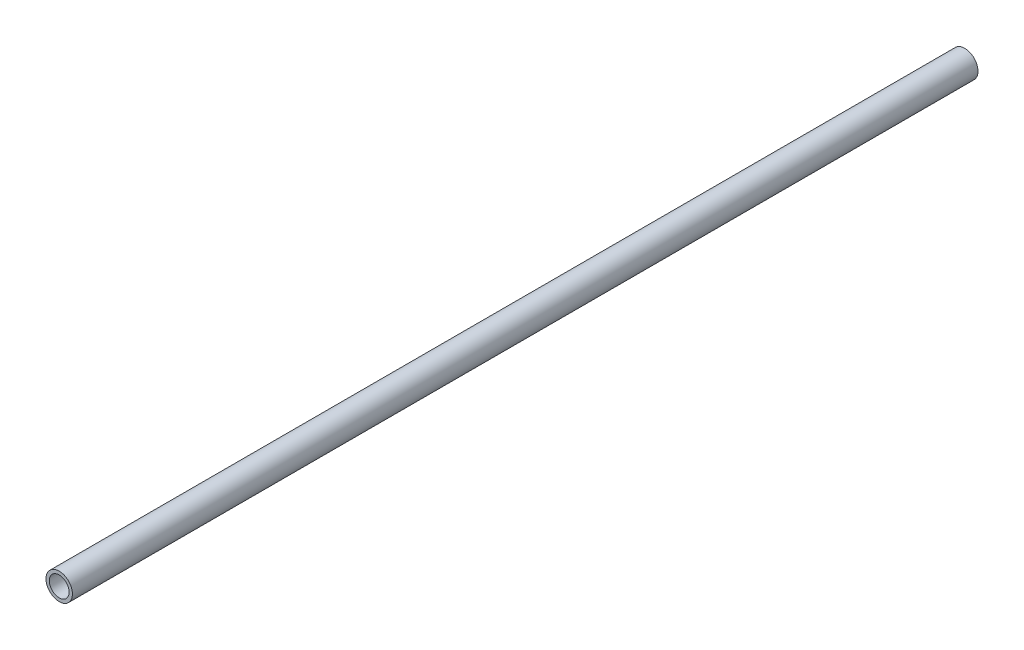
from build123d import *

# Parameters (mm, degrees)
ESQUISSE1_R        = 2
ESQUISSE1_R_2      = 1.5
EXTRU_MINCE1_DEPTH = 137


with BuildPart() as part:
    # Esquisse1 → Extru.-Mince1 (new body)
    with BuildSketch(Plane.XY):
        Circle(ESQUISSE1_R)
        Circle(ESQUISSE1_R_2, mode=Mode.SUBTRACT)
    extrude(amount=EXTRU_MINCE1_DEPTH)


solid = part.part
